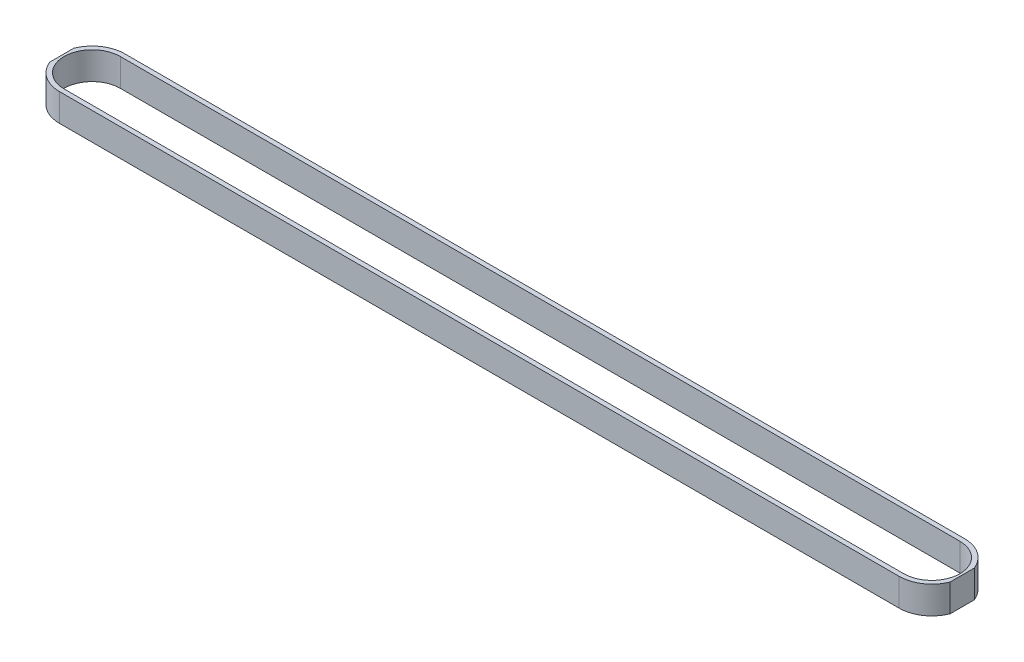
from build123d import *

# Parameters (mm, degrees)
BOSS_EXTRUDE1_DEPTH = 6
SKETCH2_W           = 1
SKETCH2_H           = 15
CUT_EXTRUDE1_DEPTH  = 190.977931876


with BuildPart() as part:
    # Sketch1 → Boss-Extrude1 (new body)
    with BuildSketch(Plane(origin=(0, 0, 0), x_dir=(1, 0, 0), z_dir=(0, 1, 0))):
        with BuildLine():
            Line((0, 7.11), (182.64, 7.11))
            ThreePointArc((182.64, 7.11), (189.75, 0), (182.64, -7.11))
            Line((182.64, -7.11), (0, -7.11))
            ThreePointArc((0, -7.11), (-7.11, 0), (0, 7.11))
        make_face()
        with BuildLine():
            Line((0, 6.112197724), (182.64, 6.112197724))
            ThreePointArc((182.64, 6.112197724), (188.752197724, 0), (182.64, -6.112197724))
            Line((182.64, -6.112197724), (0, -6.112197724))
            ThreePointArc((0, -6.112197724), (-6.112197724, 0), (0, 6.112197724))
        make_face(mode=Mode.SUBTRACT)
    extrude(amount=BOSS_EXTRUDE1_DEPTH)

    # Sketch2 → Cut-Extrude1 (cut, through all)
    with BuildSketch(Plane(origin=(0, 6, 0), x_dir=(1, 0, 0), z_dir=(0, 1, 0))):
        with Locations((189.75, 0)):
            Rectangle(SKETCH2_W, SKETCH2_H)
        with Locations((-7.11, 0)):
            Rectangle(SKETCH2_W, SKETCH2_H)
    extrude(amount=-CUT_EXTRUDE1_DEPTH, mode=Mode.SUBTRACT)


solid = part.part
